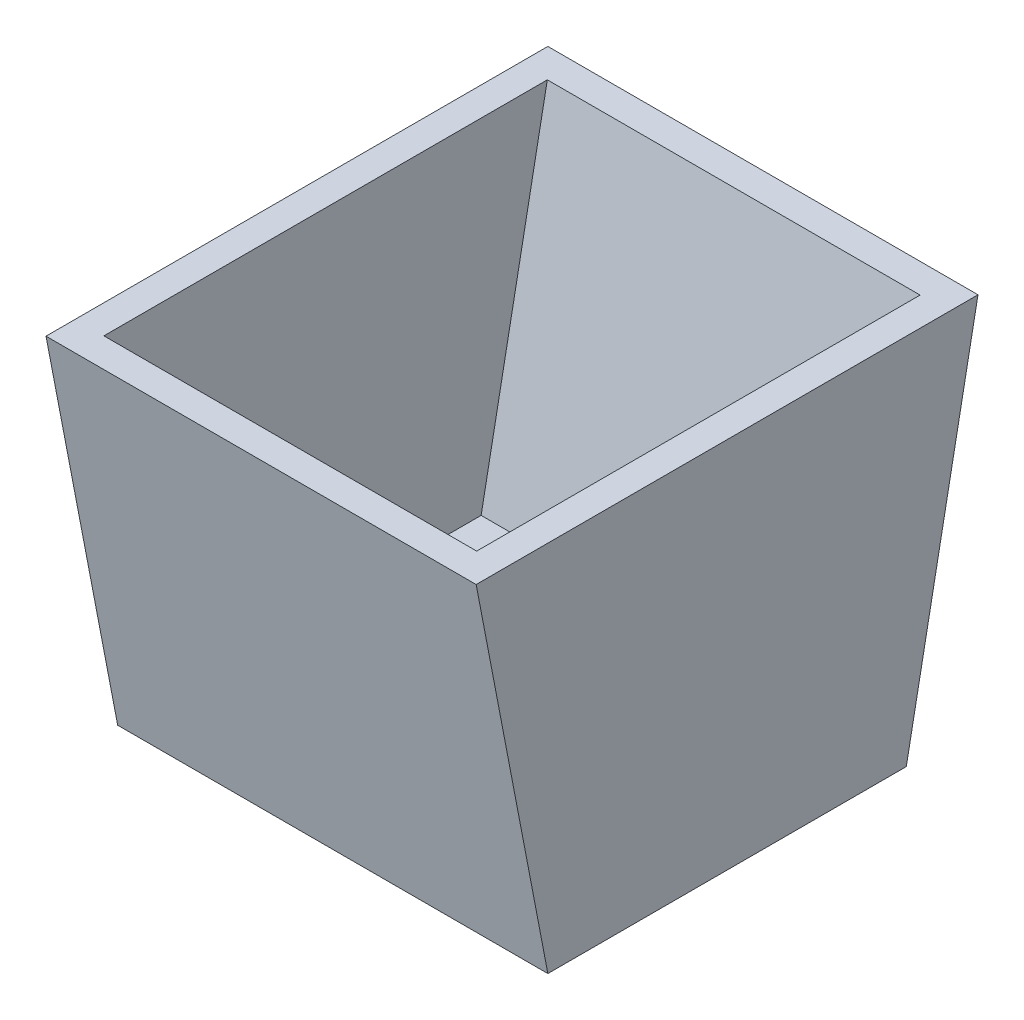
from build123d import *

# Parameters (mm, degrees)
BOSS_EXTRUDE1_DEPTH = 30
SHELL2_T            = -2


with BuildPart() as part:
    # Sketch1 → Boss-Extrude1 (new body)
    with BuildSketch(Plane(origin=(0, 0, 0), x_dir=(0, 0, -1), z_dir=(1, 0, 0))):
        Polygon((17.5, 13), (-17.5, 13), (-12.5, -13), (12.5, -13), align=None)
    extrude(amount=BOSS_EXTRUDE1_DEPTH)

    # Shell2
    shell2_openings = [part.faces().sort_by_distance(p)[0] for p in [
        (15, 13, 0),
    ]]
    offset(amount=SHELL2_T, openings=shell2_openings, kind=Kind.INTERSECTION)


solid = part.part
